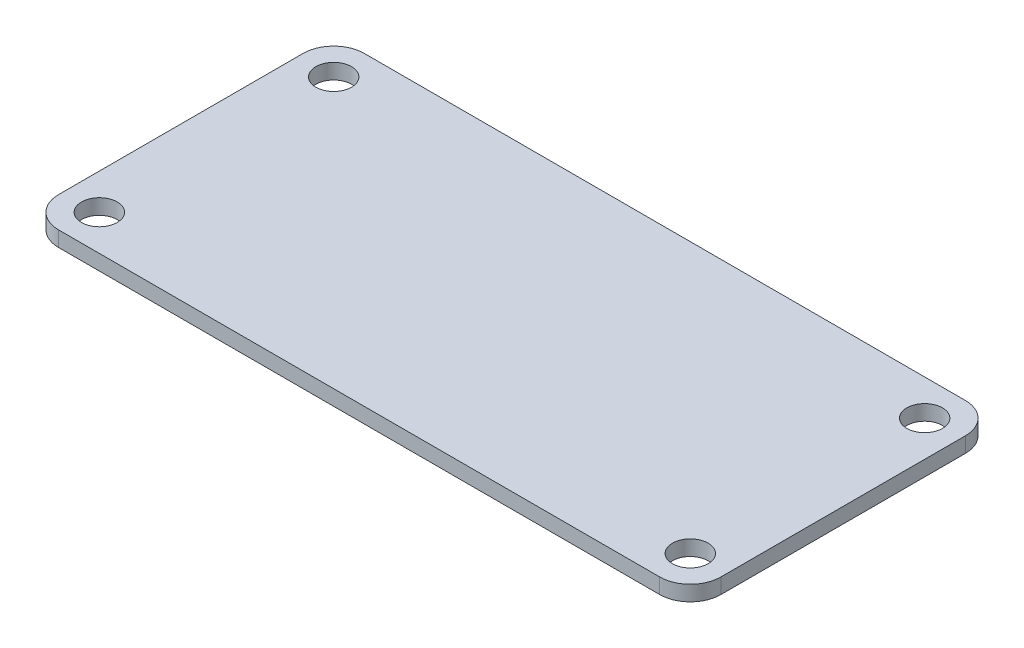
from build123d import *

# Parameters (mm, degrees)
SKETCH_1_W      = 65
SKETCH_1_H      = 30
SKETCH_1_R      = 1.75
EXTRUDE_1_DEPTH = 1.5
FILLET_1_R      = 3


with BuildPart() as part:
    # 草图1 → 凸台-拉伸1 (new body)
    with BuildSketch(Plane(origin=(0, 0, 0), x_dir=(1, 0, 0), z_dir=(0, 1, 0))):
        Rectangle(SKETCH_1_W, SKETCH_1_H)
        with Locations(Location((-29, 11.5, 0), (0, 0, 270))):
            Circle(SKETCH_1_R, mode=Mode.SUBTRACT)
        with Locations(Location((29, 11.5, 0), (0, 0, 90))):
            Circle(SKETCH_1_R, mode=Mode.SUBTRACT)
        with Locations(Location((29, -11.5, 0), (0, 0, 270))):
            Circle(SKETCH_1_R, mode=Mode.SUBTRACT)
        with Locations(Location((-29, -11.5, 0), (0, 0, 90))):
            Circle(SKETCH_1_R, mode=Mode.SUBTRACT)
    extrude(amount=EXTRUDE_1_DEPTH)

    # 圆角1
    fillet_1_edges = [part.edges().sort_by_distance(p)[0] for p in [
        (32.5, 0.75, 15),
        (-32.5, 0.75, 15),
        (-32.5, 0.75, -15),
        (32.5, 0.75, -15),
    ]]
    fillet(fillet_1_edges, radius=FILLET_1_R)


solid = part.part
